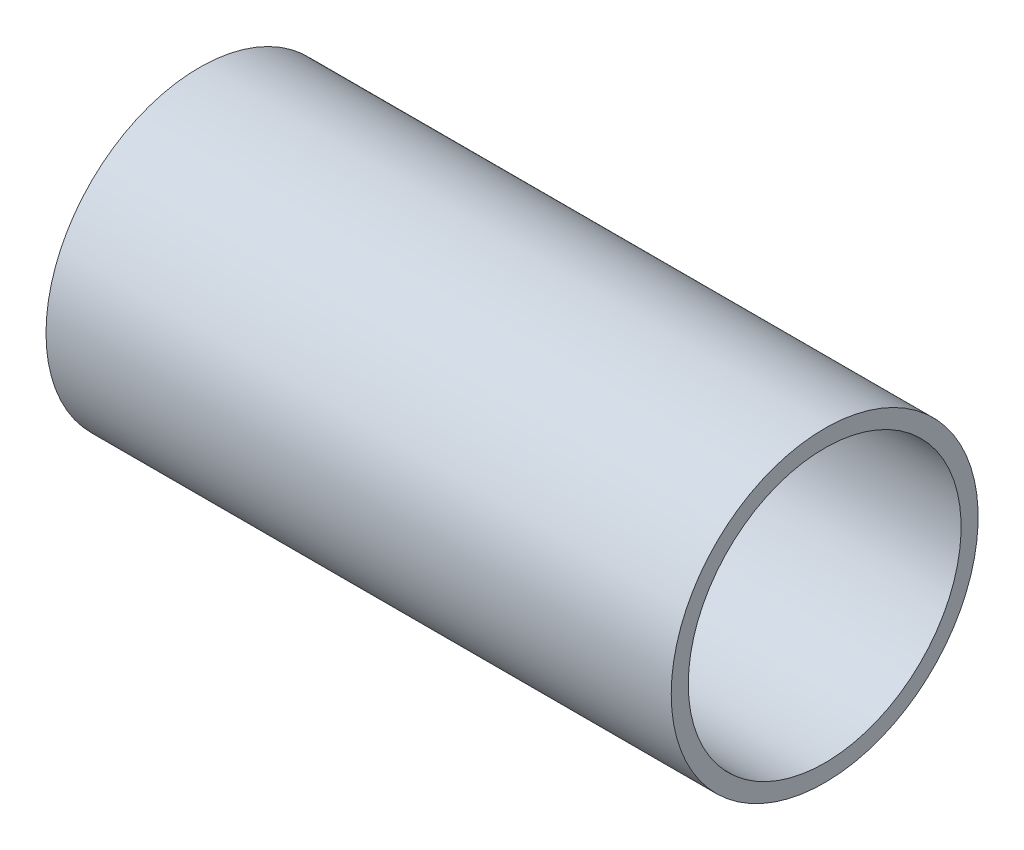
from build123d import *

# Parameters (mm, degrees)
AXIAL_PROFILE_MM_W = 110
AXIAL_PROFILE_MM_H = 3


with BuildPart() as part:
    # Axial profile (mm) → Full revolution (revolve)
    with BuildSketch(Plane.XY, mode=Mode.PRIVATE) as full_revolution_sk:
        with Locations((80.7, 25.5)):
            Rectangle(AXIAL_PROFILE_MM_W, AXIAL_PROFILE_MM_H)
    revolve(full_revolution_sk.sketch.rotate(Axis((-110, 0, 0), (1, 0, 0)), 90), axis=Axis((-110, 0, 0), (1, 0, 0)))


solid = part.part
